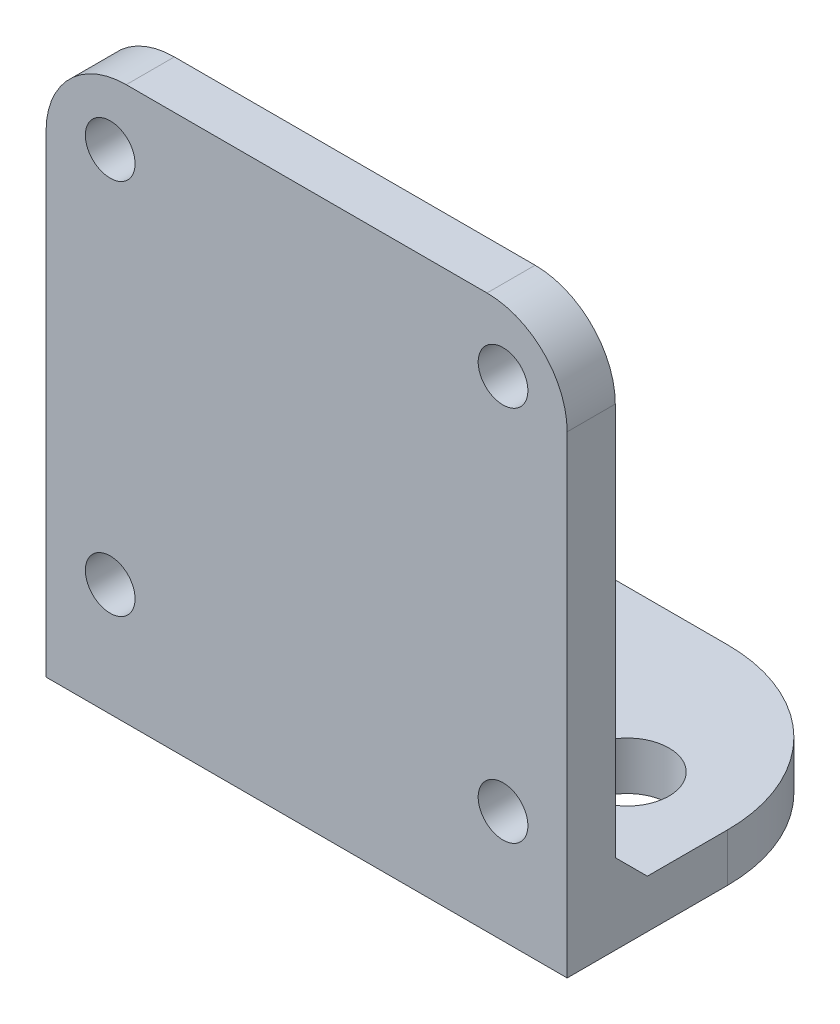
from build123d import *

# Parameters (mm, degrees)
SKETCH_1_R          = 1.55
EXTRUDE_1_DEPTH     = 3
SKETCH_2_W          = 32.5
SKETCH_2_H          = 3
EXTRUDE_2_DEPTH     = 17
SKETCH_3_R          = 2.6
CUT_EXTRUDE_1_DEPTH = 17
CHAMFER_1_SIZE      = 2
FILLET_1_R          = 10
FILLET_2_R          = 5


with BuildPart() as part:
    # 草图1 → 凸台-拉伸1 (new body)
    with BuildSketch(Plane.XY):
        Polygon((28.5, -27.5), (28.5, -30.5), (-4, -30.5), (-4, -27.5), (-4, 4), (28.5, 4), align=None)
        Circle(SKETCH_1_R, mode=Mode.SUBTRACT)
        with Locations((24.5, 0)):
            Circle(SKETCH_1_R, mode=Mode.SUBTRACT)
        with Locations((0, -23.5)):
            Circle(SKETCH_1_R, mode=Mode.SUBTRACT)
        with Locations((24.5, -23.5)):
            Circle(SKETCH_1_R, mode=Mode.SUBTRACT)
    extrude(amount=EXTRUDE_1_DEPTH)

    # 草图2 → 凸台-拉伸2 (add)
    with BuildSketch(Plane(origin=(0, 0, 0), x_dir=(-1, 0, 0), z_dir=(0, 0, -1))):
        with Locations((-12.25, -29)):
            Rectangle(SKETCH_2_W, SKETCH_2_H)
    extrude(amount=EXTRUDE_2_DEPTH)

    # 草图3 → 切除-拉伸1 (cut)
    with BuildSketch(Plane.XZ.offset(30.5)):
        with Locations(Location((22.25, -7, 0), (0, 0, 270))):
            Circle(SKETCH_3_R)
        with Locations(Location((2.25, -7, 0), (0, 0, 270))):
            Circle(SKETCH_3_R)
    extrude(amount=-CUT_EXTRUDE_1_DEPTH, mode=Mode.SUBTRACT)

    # 倒角1
    chamfer_1_edges = [part.edges().sort_by_distance(p)[0] for p in [
        (12.25, -27.5, 0),
    ]]
    chamfer(chamfer_1_edges, length=CHAMFER_1_SIZE)

    # 圆角1
    fillet_1_edges = [part.edges().sort_by_distance(p)[0] for p in [
        (28.5, -29, -17),
        (-4, -29, -17),
    ]]
    fillet(fillet_1_edges, radius=FILLET_1_R)

    # 圆角2
    fillet_2_edges = [part.edges().sort_by_distance(p)[0] for p in [
        (-4, 4, 1.5),
        (28.5, 4, 1.5),
    ]]
    fillet(fillet_2_edges, radius=FILLET_2_R)


solid = part.part
